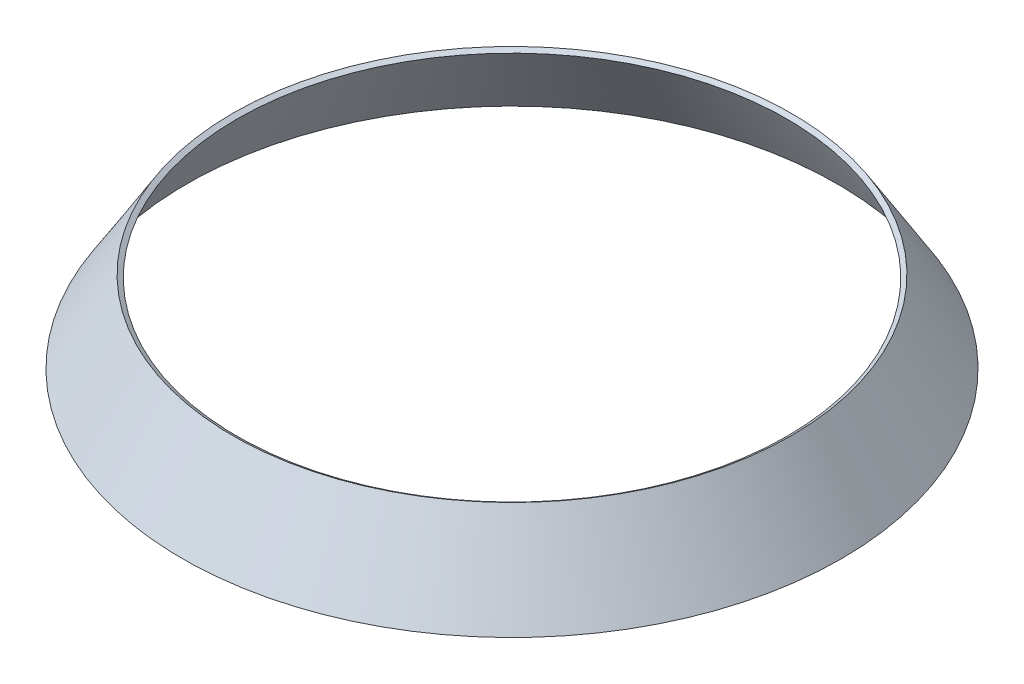
from build123d import *


with BuildPart() as part:
    # Sketch1 → Revolve1 (revolve)
    with BuildSketch(Plane.XY):
        Polygon((37.948868536, 5.714187289), (44.78, -5.346357133), (44.184432223, -5.714187289), (37.353300759, 5.346357133), align=None)
    revolve(axis=Axis((0, -1106.917829623, 0), (0, 1, 0)))


solid = part.part
